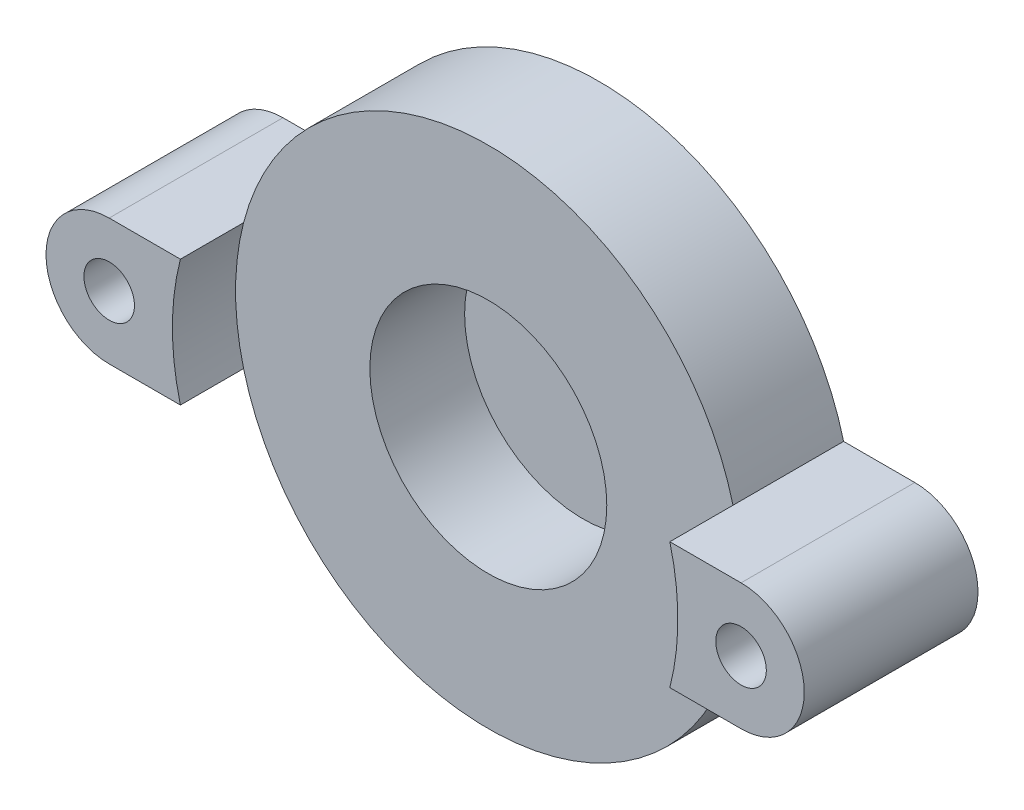
from build123d import *
from build123d.topology import SkipClean

# Parameters (mm, degrees)
BOSS_EXTRUDE1_DEPTH = 2
SKETCH2_R           = 1.6
BOSS_EXTRUDE3_DEPTH = 6
BOSS_EXTRUDE4_START = 4
SKETCH5_R           = 16
SKETCH5_R_2         = 7.5
BOSS_EXTRUDE4_DEPTH = 4
BOSS_EXTRUDE7_START = 1
SKETCH6_R           = 16
BOSS_EXTRUDE7_DEPTH = 1
BOSS_EXTRUDE8_START = -5
SKETCH7_R           = 1.6
BOSS_EXTRUDE8_DEPTH = 5


with BuildPart() as part:
    # Sketch1 → Boss-Extrude1 (new body)
    # profile 1 of 2: a face of its own
    with BuildSketch(Plane.XY):
        with BuildLine():
            ThreePointArc((15.491933385, 4), (9.797958971, 12.649110641), (0, 16))
            ThreePointArc((0, 16), (-9.797958971, 12.649110641), (-15.491933385, 4))
            ThreePointArc((-15.491933385, 4), (-16, 0), (-15.491933385, -4))
            ThreePointArc((-15.491933385, -4), (0, -16), (15.491933385, -4))
            ThreePointArc((15.491933385, -4), (15.87247514, -2.01606868), (16, 0))
            ThreePointArc((16, 0), (15.87247514, 2.01606868), (15.491933385, 4))
        make_face()
        with BuildLine():
            ThreePointArc((7.5, 0), (-5.303300859, -5.303300859), (0, 7.5))
            ThreePointArc((0, 7.5), (5.303300859, 5.303300859), (7.5, 0))
        make_face(mode=Mode.SUBTRACT)
    # profile 2 of 2: a face of its own
    with BuildSketch(Plane.XY):
        with BuildLine():
            ThreePointArc((15.491933385, 4), (9.797958971, 12.649110641), (0, 16))
            ThreePointArc((0, 16), (-9.797958971, 12.649110641), (-15.491933385, 4))
            ThreePointArc((-15.491933385, 4), (-16, 0), (-15.491933385, -4))
            ThreePointArc((-15.491933385, -4), (0, -16), (15.491933385, -4))
            ThreePointArc((15.491933385, -4), (15.87247514, -2.01606868), (16, 0))
            ThreePointArc((16, 0), (15.87247514, 2.01606868), (15.491933385, 4))
        make_face()
        with BuildLine():
            ThreePointArc((7.5, 0), (-5.303300859, -5.303300859), (0, 7.5))
            ThreePointArc((0, 7.5), (5.303300859, 5.303300859), (7.5, 0))
        make_face(mode=Mode.SUBTRACT)
    extrude(amount=BOSS_EXTRUDE1_DEPTH)

    # Sketch2 → Boss-Extrude3 (add)
    # profile 1 of 2: a face of its own
    with BuildSketch(Plane.XY):
        with BuildLine():
            Line((-20, -4), (-15.491933385, -4))
            ThreePointArc((-15.491933385, -4), (-16, 0), (-15.491933385, 4))
            Line((-15.491933385, 4), (-20, 4))
            ThreePointArc((-20, 4), (-24, 0), (-20, -4))
        make_face()
        with Locations((-20, 0)):
            Circle(SKETCH2_R, mode=Mode.SUBTRACT)
    # profile 2 of 2: a face of its own
    with BuildSketch(Plane.XY):
        with BuildLine():
            Line((15.491933385, -4), (20, -4))
            ThreePointArc((20, -4), (24, 0), (20, 4))
            Line((20, 4), (15.491933385, 4))
            ThreePointArc((15.491933385, 4), (15.87247514, 2.01606868), (16, 0))
            ThreePointArc((16, 0), (15.87247514, -2.01606868), (15.491933385, -4))
        make_face()
        with Locations((20, 0)):
            Circle(SKETCH2_R, mode=Mode.SUBTRACT)
    extrude(amount=BOSS_EXTRUDE3_DEPTH)

    # Sketch5 → Boss-Extrude4 (add)
    with SkipClean():  # the faces are left unmerged after this step: merging them gives an invalid solid
        with BuildSketch(Plane(origin=(0, 0, 0), x_dir=(-1, 0, 0), z_dir=(0, 0, -1)).offset(BOSS_EXTRUDE4_START)):
            Circle(SKETCH5_R)
            Circle(SKETCH5_R_2, mode=Mode.SUBTRACT)
        extrude(amount=-BOSS_EXTRUDE4_DEPTH)

    # Sketch6 → Boss-Extrude7 (add)
    with SkipClean():  # the faces are left unmerged after this step: merging them gives an invalid solid
        with BuildSketch(Plane(origin=(0, 0, -4), x_dir=(-1, 0, 0), z_dir=(0, 0, -1)).offset(BOSS_EXTRUDE7_START)):
            Circle(SKETCH6_R)
        extrude(amount=-BOSS_EXTRUDE7_DEPTH)

    # Sketch7 → Boss-Extrude8 (add)
    # profile 1 of 2: a face of its own
    with SkipClean():  # the faces are left unmerged after this step: merging them gives an invalid solid
        with BuildSketch(Plane.XY.offset(BOSS_EXTRUDE8_START)):
            with BuildLine():
                Line((15.491933385, -4), (20, -4))
                ThreePointArc((20, -4), (24, 0), (20, 4))
                Line((20, 4), (15.491933385, 4))
                ThreePointArc((15.491933385, 4), (15.87247514, 2.01606868), (16, 0))
                ThreePointArc((16, 0), (15.87247514, -2.01606868), (15.491933385, -4))
            make_face()
            with Locations((20, 0)):
                Circle(SKETCH7_R, mode=Mode.SUBTRACT)
        # profile 2 of 2: a face of its own
        with BuildSketch(Plane.XY.offset(BOSS_EXTRUDE8_START)):
            with BuildLine():
                Line((-20, -4), (-15.491933385, -4))
                ThreePointArc((-15.491933385, -4), (-16, 0), (-15.491933385, 4))
                Line((-15.491933385, 4), (-20, 4))
                ThreePointArc((-20, 4), (-24, 0), (-20, -4))
            make_face()
            with Locations((-20, 0)):
                Circle(SKETCH7_R, mode=Mode.SUBTRACT)
        extrude(amount=BOSS_EXTRUDE8_DEPTH)


solid = part.part
